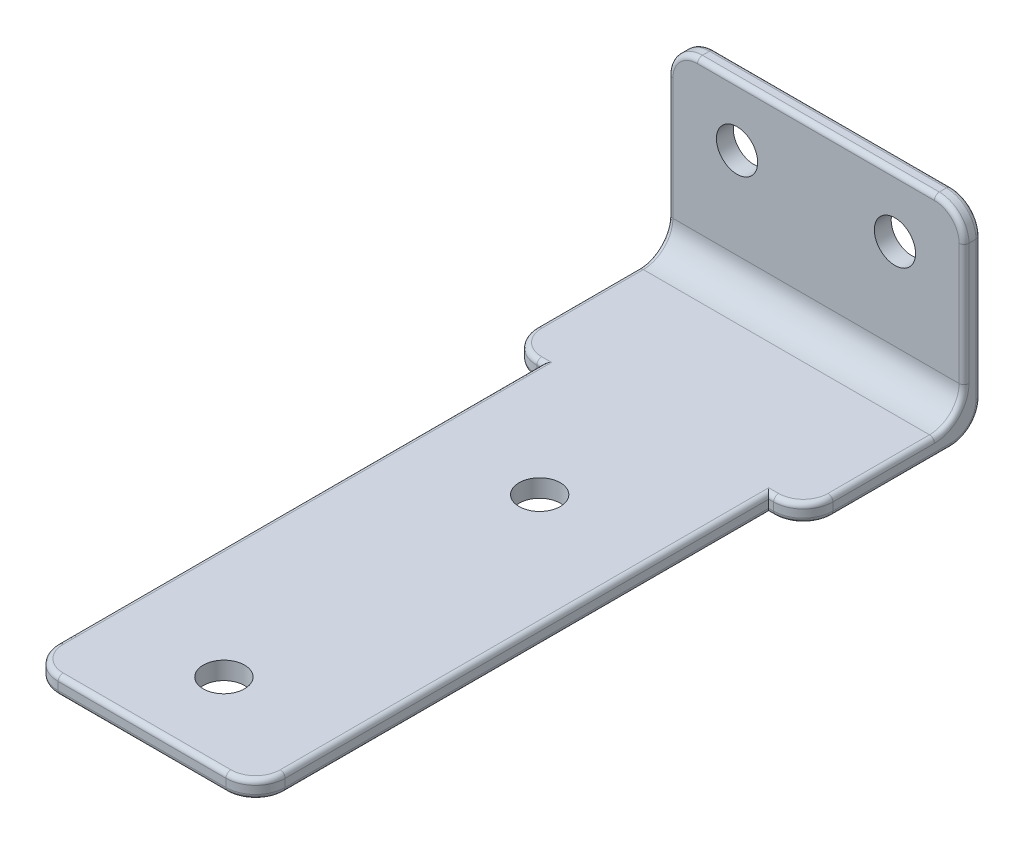
from build123d import *

# Parameters (mm, degrees)
SKETCH1_W                  = 38.1
SKETCH1_H                  = 88.9
BOSS_BASE_DEPTH            = 2.286
SKETCH3_W                  = 38.1
SKETCH3_H                  = 2.1717
BOSS_LIP_DEPTH             = 23.25116
F_4_0_209_DIAMETER_HOLE1_D = 5.3086
F_4_0_209_DIAMETER_HOLE2_D = 5.3086
SKETCH19_W                 = 4.445
SKETCH19_H                 = 66.04
CUT_EXTRUDE1_DEPTH         = 54.659308991
FILLET1_R                  = 3.81
FILLET4_R                  = 0.635


with BuildPart() as part:
    # Sketch1 → Boss-Base (new body)
    with BuildSketch(Plane(origin=(0, 0, 0), x_dir=(1, 0, 0), z_dir=(0, 1, 0))):
        Rectangle(SKETCH1_W, SKETCH1_H)
    extrude(amount=BOSS_BASE_DEPTH)

    # Sketch3 → Boss-Lip (add)
    with BuildSketch(Plane(origin=(0, 2.286, 0), x_dir=(1, 0, 0), z_dir=(0, 1, 0))):
        with Locations((0, 43.36415)):
            Rectangle(SKETCH3_W, SKETCH3_H)
    extrude(amount=BOSS_LIP_DEPTH)

    # #4 (0.209) Diameter Hole1 (through all)
    with Locations(Plane(origin=(0, 2.286, 0), x_dir=(1, 0, 0), z_dir=(0, 1, 0))):
        with Locations((0, -33.9217), (0, 6.7183)):
            Hole(F_4_0_209_DIAMETER_HOLE1_D / 2)

    # #4 (0.209) Diameter Hole2 (through all)
    with Locations(Plane.XY.offset(-42.2783)):
        with Locations((10.16, 17.78), (-10.16, 17.78)):
            Hole(F_4_0_209_DIAMETER_HOLE2_D / 2)

    # Sketch19 → Cut-Extrude1 (cut, through all)
    with BuildSketch(Plane(origin=(0, 2.286, 0), x_dir=(1, 0, 0), z_dir=(0, 1, 0))):
        with Locations((16.8275, -11.43)):
            Rectangle(SKETCH19_W, SKETCH19_H)
        with Locations((-16.8275, -11.43)):
            Rectangle(SKETCH19_W, SKETCH19_H)
    extrude(amount=-CUT_EXTRUDE1_DEPTH, mode=Mode.SUBTRACT)

    # Fillet1
    fillet1_edges = [part.edges().sort_by_distance(p)[0] for p in [
        (0, 2.286, -42.2783),
        (-19.05, 25.53716, -43.36415),
        (19.05, 25.53716, -43.36415),
        (0, 0, -44.45),
        (19.05, 1.143, -21.59),
        (14.605, 1.143, 44.45),
        (-19.05, 1.143, -21.59),
        (-14.605, 1.143, 44.45),
    ]]
    fillet(fillet1_edges, radius=FILLET1_R)

    # Fillet4
    fillet4_edges = [part.edges().sort_by_distance(p)[0] for p in [
        (19.05, 1.115923164, -43.334076836),
        (19.05, 3.401923164, -41.162376836),
        (-19.05, 3.401923164, -41.162376836),
        (14.605, 0, 9.525),
        (14.605, 2.286, 9.525),
        (-14.9225, 0, -21.59),
        (-14.9225, 2.286, -21.59),
        (19.05, 13.91158, -42.2783),
        (0, 25.53716, -42.2783),
        (-19.05, 13.91158, -42.2783),
        (17.934076836, 24.421236836, -42.2783),
        (-17.934076836, 24.421236836, -42.2783),
        (14.9225, 2.286, -21.59),
        (19.05, 2.286, -31.93415),
        (-19.05, 2.286, -31.93415),
        (-14.605, 2.286, 9.525),
        (0, 2.286, 44.45),
        (-17.934076836, 2.286, -22.705923164),
        (17.934076836, 2.286, -22.705923164),
        (13.489076836, 2.286, 43.334076836),
        (-13.489076836, 2.286, 43.334076836),
        (-19.05, 12.76858, -44.45),
        (0, 25.53716, -44.45),
        (19.05, 12.76858, -44.45),
        (17.934076836, 24.421236836, -44.45),
        (-17.934076836, 24.421236836, -44.45),
        (-19.05, 0, -33.02),
        (-19.05, 1.115923164, -43.334076836),
        (14.9225, 0, -21.59),
        (0, 0, 44.45),
        (-14.605, 0, 9.525),
        (19.05, 0, -33.02),
        (-17.934076836, 0, -22.705923164),
        (17.934076836, 0, -22.705923164),
        (13.489076836, 0, 43.334076836),
        (-13.489076836, 0, 43.334076836),
    ]]
    fillet(fillet4_edges, radius=FILLET4_R)


solid = part.part
